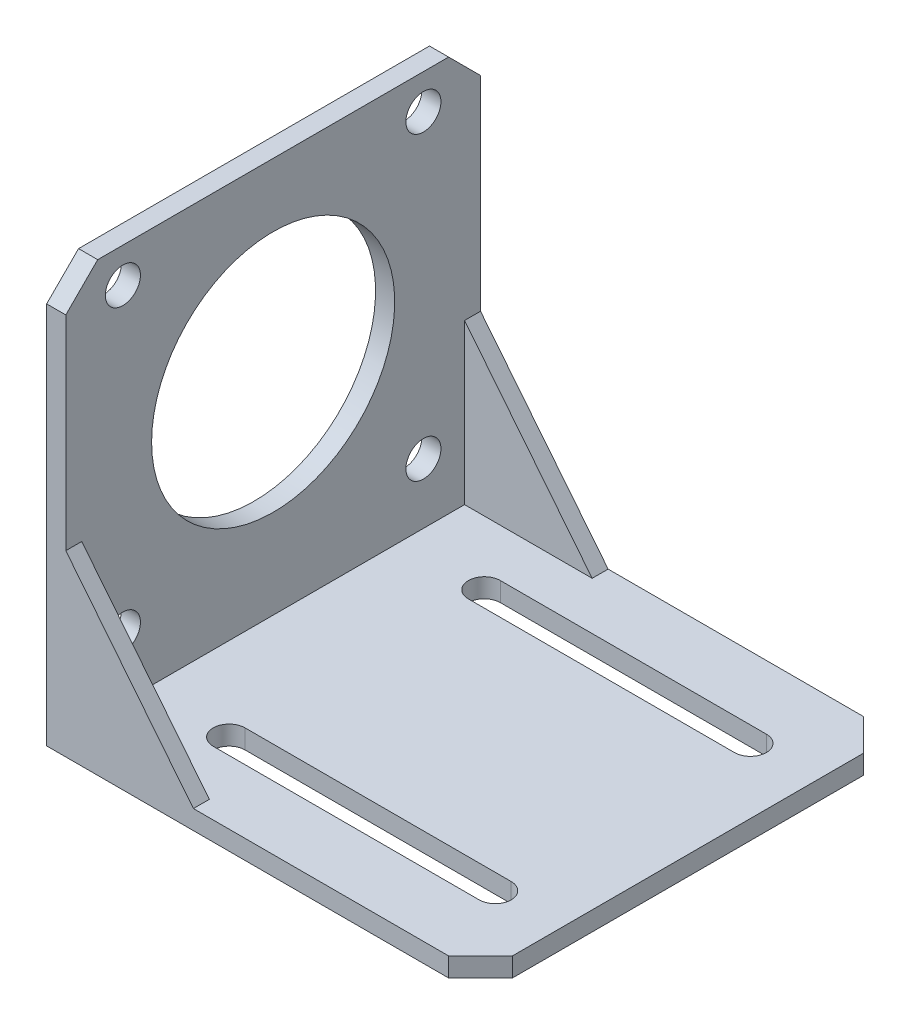
from build123d import *

# Parameters (mm, degrees)
SKETCH2_W                  = 68
SKETCH2_H                  = 65
BOSS_EXTRUDE1_DEPTH        = 3
SKETCH3_W                  = 3
SKETCH3_H                  = 65
BOSS_EXTRUDE2_DEPTH        = 62
CUT_EXTRUDE1_DEPTH         = 78.821912081
SKETCH5_R                  = 19.05
CUT_EXTRUDE2_DEPTH         = 100.525122457
F_5_5_5_5_DIAMETER_HOLE1_D = 5.5
CHAMFER1_SIZE              = 5
CHAMFER2_SIZE              = 5
CHAMFER3_SIZE              = 5
BOSS_EXTRUDE3_DEPTH        = 2.5
BOSS_EXTRUDE4_DEPTH        = 2.5


with BuildPart() as part:
    # Sketch2 → Boss-Extrude1 (new body)
    with BuildSketch(Plane(origin=(0, 0, 0), x_dir=(1, 0, 0), z_dir=(0, 1, 0))):
        Rectangle(SKETCH2_W, SKETCH2_H)
    extrude(amount=BOSS_EXTRUDE1_DEPTH)

    # Sketch3 → Boss-Extrude2 (add)
    with BuildSketch(Plane(origin=(0, 3, 0), x_dir=(1, 0, 0), z_dir=(0, 1, 0))):
        with Locations((-32.5, 0)):
            Rectangle(SKETCH3_W, SKETCH3_H)
    extrude(amount=BOSS_EXTRUDE2_DEPTH)

    # Sketch4 → Cut-Extrude1 (cut, through all)
    with BuildSketch(Plane(origin=(0, 3, 0), x_dir=(1, 0, 0), z_dir=(0, 1, 0))):
        with BuildLine():
            Line((-17.9, 22.5), (23.8, 22.5))
            ThreePointArc((23.8, 22.5), (26.3, 20), (23.8, 17.5))
            Line((23.8, 17.5), (-17.9, 17.5))
            ThreePointArc((-17.9, 17.5), (-20.4, 20), (-17.9, 22.5))
        make_face()
        with BuildLine():
            Line((-17.9, -17.5), (23.8, -17.5))
            ThreePointArc((23.8, -17.5), (26.3, -20), (23.8, -22.5))
            Line((23.8, -22.5), (-17.9, -22.5))
            ThreePointArc((-17.9, -22.5), (-20.4, -20), (-17.9, -17.5))
        make_face()
    extrude(amount=-CUT_EXTRUDE1_DEPTH, mode=Mode.SUBTRACT)

    # Sketch5 → Cut-Extrude2 (cut, through all)
    with BuildSketch(Plane.ZY.offset(34)):
        with Locations((0, 36)):
            Circle(SKETCH5_R)
    extrude(amount=-CUT_EXTRUDE2_DEPTH, mode=Mode.SUBTRACT)

    # Ø5.5 (5.5) Diameter Hole1 (through all)
    with Locations(Plane.ZY.offset(34)):
        with Locations((23.55, 59.55), (-23.55, 59.55), (-23.55, 12.45), (23.55, 12.45)):
            Hole(F_5_5_5_5_DIAMETER_HOLE1_D / 2)

    # Chamfer1
    chamfer1_edges = [part.edges().sort_by_distance(p)[0] for p in [
        (-32.5, 65, -32.5),
    ]]
    chamfer(chamfer1_edges, length=CHAMFER1_SIZE)

    # Chamfer2
    chamfer2_edges = [part.edges().sort_by_distance(p)[0] for p in [
        (-32.5, 65, 32.5),
    ]]
    chamfer(chamfer2_edges, length=CHAMFER2_SIZE)

    # Chamfer3
    chamfer3_edges = [part.edges().sort_by_distance(p)[0] for p in [
        (34, 1.5, 32.5),
        (34, 1.5, -32.5),
    ]]
    chamfer(chamfer3_edges, length=CHAMFER3_SIZE)

    # Sketch8 → Boss-Extrude3 (add)
    with BuildSketch(Plane.XY.offset(32.5)):
        Polygon((-31, 3), (-31, 28), (-11, 3), align=None)
    extrude(amount=-BOSS_EXTRUDE3_DEPTH)

    # Sketch9 → Boss-Extrude4 (add)
    with BuildSketch(Plane(origin=(0, 0, -32.5), x_dir=(-1, 0, 0), z_dir=(0, 0, -1))):
        Polygon((31, 3), (31, 28), (11, 3), align=None)
    extrude(amount=-BOSS_EXTRUDE4_DEPTH)


solid = part.part
